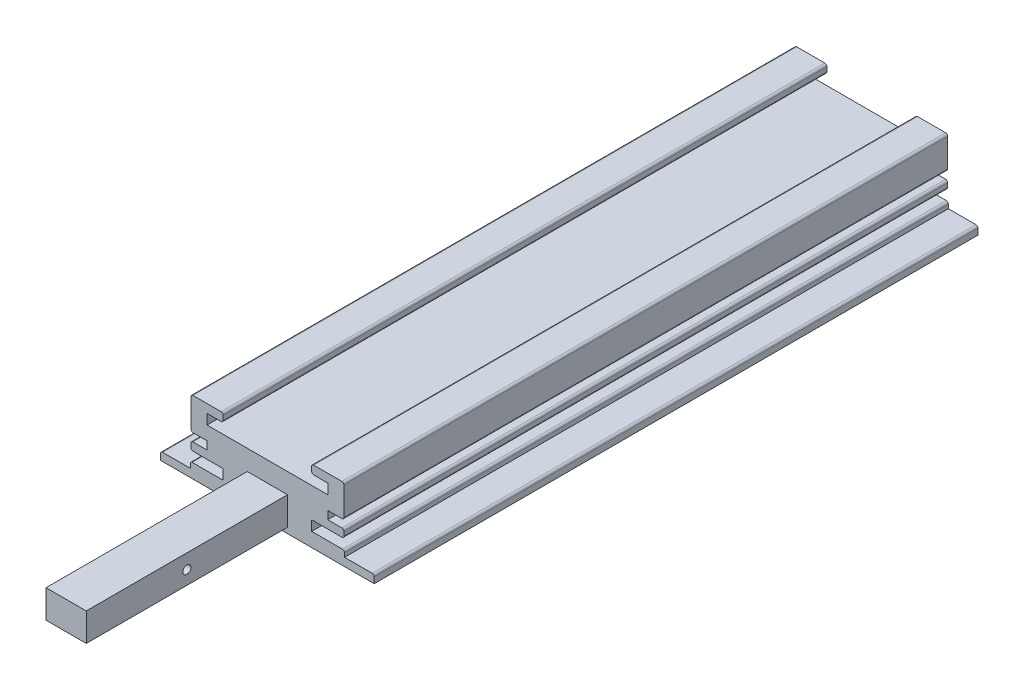
from build123d import *

# Parameters (mm, degrees)
BOSS_EXTRUDE1_DEPTH = 150
SKETCH2_W           = 10
SKETCH2_H           = 7
BOSS_EXTRUDE4_DEPTH = 50
SKETCH4_R           = 1
CUT_EXTRUDE2_DEPTH  = 50
SKETCH5_W           = 10
SKETCH5_H           = 7
CUT_EXTRUDE3_DEPTH  = 50
SKETCH6_R           = 1
CUT_EXTRUDE4_DEPTH  = 100


with BuildPart() as part:
    # Sketch1 → Boss-Extrude1 (new body)
    with BuildSketch(Plane.XY):
        with BuildLine():
            Line((-15, 12.912739296), (15, 12.912739296))
            Line((15, 12.912739296), (15, 15.412739296))
            Line((15, 15.412739296), (11.5, 15.412739296))
            ThreePointArc((11.5, 15.412739296), (11.146446609, 15.559185905), (11, 15.912739296))
            Line((11, 15.912739296), (11, 17.028604707))
            ThreePointArc((11, 17.028604707), (11.146446609, 17.382158098), (11.5, 17.528604707))
            Line((11.5, 17.528604707), (18.5, 17.528604707))
            ThreePointArc((18.5, 17.528604707), (18.853553391, 17.382158098), (19, 17.028604707))
            Line((19, 17.028604707), (19, 10.028604707))
            ThreePointArc((19, 10.028604707), (18.853553391, 9.675051316), (18.5, 9.528604707))
            Line((18.5, 9.528604707), (15, 9.528604707))
            Line((15, 9.528604707), (15, 7.528604707))
            Line((15, 7.528604707), (18.5, 7.528604707))
            ThreePointArc((18.5, 7.528604707), (18.853553391, 7.382158098), (19, 7.028604707))
            Line((19, 7.028604707), (19, 6.028604707))
            ThreePointArc((19, 6.028604707), (18.853553391, 5.675051316), (18.5, 5.528604707))
            Line((18.5, 5.528604707), (11, 5.528604707))
            Line((11, 5.528604707), (11, 3.028604707))
            Line((11, 3.028604707), (18.661195157, 3.028604707))
            ThreePointArc((18.661195157, 3.028604707), (19.014748547, 2.882158098), (19.161195157, 2.528604707))
            Line((19.161195157, 2.528604707), (19.161195157, 1.528604707))
            Line((19.161195157, 1.528604707), (26.029307443, 1.528604707))
            ThreePointArc((26.029307443, 1.528604707), (26.382860834, 1.382158098), (26.529307443, 1.028604707))
            Line((26.529307443, 1.028604707), (26.529307443, -0.471395293))
            Line((26.529307443, -0.471395293), (11.070535665, -0.471395293))
            Line((11.070535665, -0.471395293), (-11.070535665, -0.471395293))
            Line((-11.070535665, -0.471395293), (-26.529307443, -0.471395293))
            Line((-26.529307443, -0.471395293), (-26.529307443, 1.028604707))
            ThreePointArc((-26.529307443, 1.028604707), (-26.382860834, 1.382158098), (-26.029307443, 1.528604707))
            Line((-26.029307443, 1.528604707), (-19.161195157, 1.528604707))
            Line((-19.161195157, 1.528604707), (-19.161195157, 2.528604707))
            ThreePointArc((-19.161195157, 2.528604707), (-19.014748547, 2.882158098), (-18.661195157, 3.028604707))
            Line((-18.661195157, 3.028604707), (-11, 3.028604707))
            Line((-11, 3.028604707), (-11, 5.528604707))
            Line((-11, 5.528604707), (-18.5, 5.528604707))
            ThreePointArc((-18.5, 5.528604707), (-18.853553391, 5.675051316), (-19, 6.028604707))
            Line((-19, 6.028604707), (-19, 7.028604707))
            ThreePointArc((-19, 7.028604707), (-18.853553391, 7.382158098), (-18.5, 7.528604707))
            Line((-18.5, 7.528604707), (-15, 7.528604707))
            Line((-15, 7.528604707), (-15, 9.528604707))
            Line((-15, 9.528604707), (-18.5, 9.528604707))
            ThreePointArc((-18.5, 9.528604707), (-18.853553391, 9.675051316), (-19, 10.028604707))
            Line((-19, 10.028604707), (-19, 17.028604707))
            ThreePointArc((-19, 17.028604707), (-18.853553391, 17.382158098), (-18.5, 17.528604707))
            Line((-18.5, 17.528604707), (-11.5, 17.528604707))
            ThreePointArc((-11.5, 17.528604707), (-11.146446609, 17.382158098), (-11, 17.028604707))
            Line((-11, 17.028604707), (-11, 15.912739296))
            ThreePointArc((-11, 15.912739296), (-11.146446609, 15.559185905), (-11.5, 15.412739296))
            Line((-11.5, 15.412739296), (-15, 15.412739296))
            Line((-15, 15.412739296), (-15, 12.912739296))
        make_face()
    extrude(amount=BOSS_EXTRUDE1_DEPTH)

    # Sketch2 → Boss-Extrude4 (add)
    with BuildSketch(Plane.XY.offset(150)):
        with Locations((0, 4.412739296)):
            Rectangle(SKETCH2_W, SKETCH2_H)
    extrude(amount=BOSS_EXTRUDE4_DEPTH)

    # Sketch4 → Cut-Extrude2 (cut)
    with BuildSketch(Plane(origin=(5, 0, 0), x_dir=(0, 0, -1), z_dir=(1, 0, 0))):
        with Locations(Location((-175, 4.282739296, 0), (0, 0, 90))):
            Circle(SKETCH4_R)
    extrude(amount=-CUT_EXTRUDE2_DEPTH, mode=Mode.SUBTRACT)

    # Sketch5 → Cut-Extrude3 (cut)
    with BuildSketch(Plane(origin=(0, 0, 0), x_dir=(-1, 0, 0), z_dir=(0, 0, -1))):
        with Locations((0, 4.412739296)):
            Rectangle(SKETCH5_W, SKETCH5_H)
    extrude(amount=-CUT_EXTRUDE3_DEPTH, mode=Mode.SUBTRACT)

    # Sketch6 → Cut-Extrude4 (cut)
    with BuildSketch(Plane.ZY.offset(11)):
        with Locations(Location((25, 4.278604707, 0), (0, 0, 270))):
            Circle(SKETCH6_R)
    extrude(amount=-CUT_EXTRUDE4_DEPTH, mode=Mode.SUBTRACT)


solid = part.part
